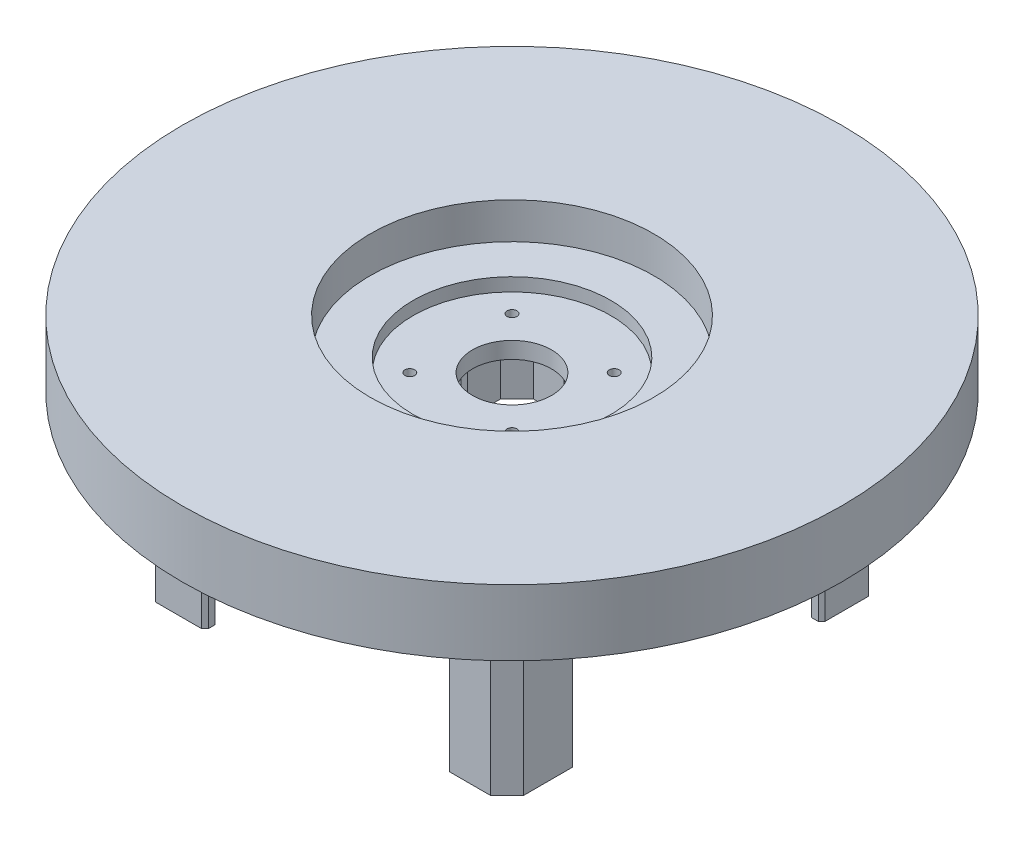
from build123d import *

# Parameters (mm, degrees)
SKETCH_1_R          = 100
EXTRUDE_1_DEPTH     = 5
SKETCH_3_R          = 3
CUT_EXTRUDE_1_DEPTH = 142.509716981
SKETCH_5_R          = 1.5
CUT_EXTRUDE_2_DEPTH = 142.509716981
SKETCH_6_R          = 12
CUT_EXTRUDE_3_DEPTH = 142.509716981
EXTRUDE_2_DEPTH     = 57
SKETCH_9_R          = 100
SKETCH_9_R_2        = 30
EXTRUDE_4_DEPTH     = 15
SKETCH_10_R         = 43
CUT_EXTRUDE_4_DEPTH = 11


with BuildPart() as part:
    # 草图1 → 凸台-拉伸1 (new body)
    with BuildSketch(Plane(origin=(0, 0, 0), x_dir=(1, 0, 0), z_dir=(0, 1, 0))):
        with Locations(Location((0, 0, 0), (0, 0, 270))):
            Circle(SKETCH_1_R)
    extrude(amount=EXTRUDE_1_DEPTH)

    # 草图3 → 切除-拉伸1 (cut, through all)
    with BuildSketch(Plane.XZ):
        with Locations(Location((0, 90, 0), (0, 0, 270))):
            Circle(SKETCH_3_R)
        with Locations(Location((90, 0, 0), (0, 0, 270))):
            Circle(SKETCH_3_R)
        with Locations(Location((0, -90, 0), (0, 0, 270))):
            Circle(SKETCH_3_R)
        with Locations(Location((-90, 0, 0), (0, 0, 270))):
            Circle(SKETCH_3_R)
    extrude(amount=-CUT_EXTRUDE_1_DEPTH, mode=Mode.SUBTRACT)

    # 草图5 → 切除-拉伸2 (cut, through all)
    with BuildSketch(Plane(origin=(0, 5, 0), x_dir=(1, 0, 0), z_dir=(0, 1, 0))):
        with Locations(Location((-15.5, 15.5, 0), (0, 0, 270))):
            Circle(SKETCH_5_R)
        with Locations(Location((15.5, 15.5, 0), (0, 0, 270))):
            Circle(SKETCH_5_R)
        with Locations(Location((-15.5, -15.5, 0), (0, 0, 270))):
            Circle(SKETCH_5_R)
        with Locations(Location((15.5, -15.5, 0), (0, 0, 270))):
            Circle(SKETCH_5_R)
    extrude(amount=-CUT_EXTRUDE_2_DEPTH, mode=Mode.SUBTRACT)

    # 草图6 → 切除-拉伸3 (cut, through all)
    with BuildSketch(Plane(origin=(0, 5, 0), x_dir=(1, 0, 0), z_dir=(0, 1, 0))):
        with Locations(Location((0, 0, 0), (0, 0, 270))):
            Circle(SKETCH_6_R)
    extrude(amount=-CUT_EXTRUDE_3_DEPTH, mode=Mode.SUBTRACT)

    # 草图7 → 凸台-拉伸2 (add)
    with BuildSketch(Plane(origin=(0, 5, 0), x_dir=(1, 0, 0), z_dir=(0, 1, 0))):
        Polygon((-50.809093778, 57.317929583), (-37.568542495, 57.317929583), (-36.568542495, 56.317929583), (-36.568542495, 54.317929583), (-37.568542495, 53.317929583), (-46.809093778, 53.317929583), (-51.809093778, 48.317929583), (-51.809093778, 38.348523411), (-52.809093778, 37.348523411), (-54.809093778, 37.348523411), (-55.809093778, 38.348523411), (-55.809093778, 52.317929583), align=None)
        Polygon((-55.809093778, -52.317929583), (-55.809093778, -36.788561579), (-54.809093778, -35.788561579), (-52.809093778, -35.788561579), (-51.809093778, -36.788561579), (-51.809093778, -48.317929583), (-46.809093778, -53.317929583), (-36.809093778, -53.317929583), (-35.809093778, -54.317929583), (-35.809093778, -56.317929583), (-36.809093778, -57.317929583), (-50.809093778, -57.317929583), align=None)
        Polygon((55.809093778, -52.317929583), (55.809093778, -37.390513406), (54.809093778, -36.390513406), (52.809093778, -36.390513406), (51.809093778, -37.390513406), (51.809093778, -48.317929583), (46.809093778, -53.317929583), (38.327991212, -53.317929583), (37.327991212, -54.317929583), (37.327991212, -56.317929583), (38.327991212, -57.317929583), (50.809093778, -57.317929583), align=None)
        Polygon((50.809093778, 57.317929583), (37.568542495, 57.317929583), (36.568542495, 56.317929583), (36.568542495, 54.317929583), (37.568542495, 53.317929583), (46.809093778, 53.317929583), (51.809093778, 48.317929583), (51.809093778, 39.097910499), (52.809093778, 38.097910499), (54.809093778, 38.097910499), (55.809093778, 39.097910499), (55.809093778, 52.317929583), align=None)
    extrude(amount=-EXTRUDE_2_DEPTH)

    # 草图9 → 凸台-拉伸4 (add)
    with BuildSketch(Plane(origin=(0, 5, 0), x_dir=(1, 0, 0), z_dir=(0, 1, 0))):
        with Locations(Location((0, 0, 0), (0, 0, 270))):
            Circle(SKETCH_9_R)
        with Locations(Location((0, 0, 0), (0, 0, 270))):
            Circle(SKETCH_9_R_2, mode=Mode.SUBTRACT)
    extrude(amount=EXTRUDE_4_DEPTH)

    # 草图10 → 切除-拉伸4 (cut)
    with BuildSketch(Plane(origin=(0, 20, 0), x_dir=(1, 0, 0), z_dir=(0, 1, 0))):
        with Locations(Location((0, 0, 0), (0, 0, 270))):
            Circle(SKETCH_10_R)
    extrude(amount=-CUT_EXTRUDE_4_DEPTH, mode=Mode.SUBTRACT)


solid = part.part
